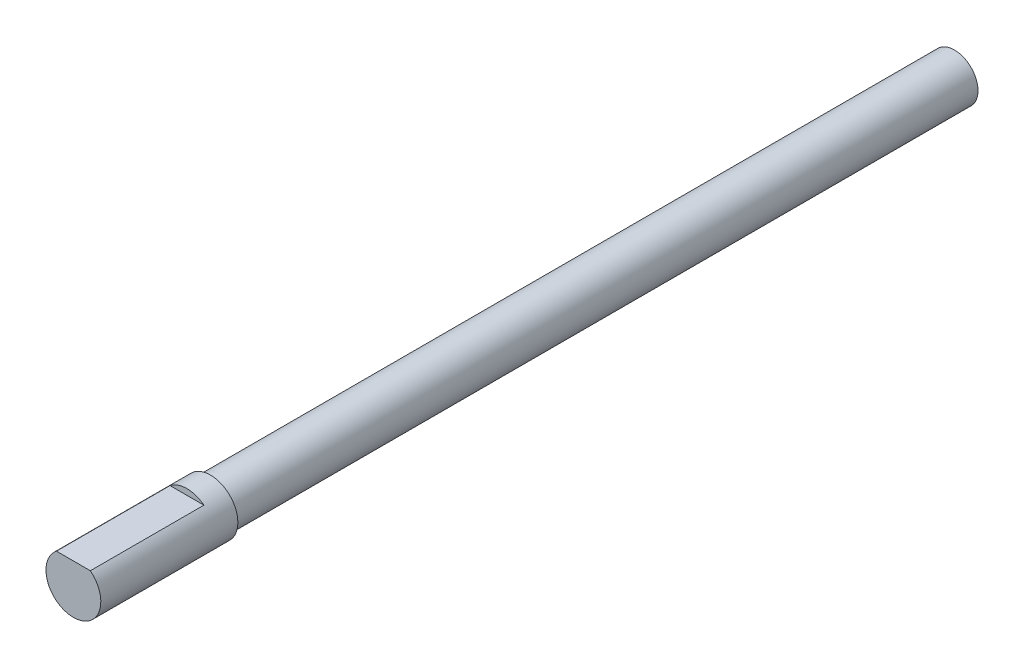
from build123d import *

# Parameters (mm, degrees)
ESQUISSE1_R             = 6
BOSS_EXTRU_1_DEPTH      = 190
ESQUISSE2_R             = 7
BOSS_EXTRU_2_DEPTH      = 35
ESQUISSE3_R             = 3
ENL_V_MAT_EXTRU_1_DEPTH = 20
ESQUISSE4_W             = 10.048379513
ESQUISSE4_H             = 5
ENL_V_MAT_EXTRU_2_DEPTH = 29


with BuildPart() as part:
    # Esquisse1 → Boss.-Extru.1 (new body)
    with BuildSketch(Plane.XY):
        Circle(ESQUISSE1_R)
    extrude(amount=BOSS_EXTRU_1_DEPTH)

    # Esquisse2 → Boss.-Extru.2 (add)
    with BuildSketch(Plane.XY.offset(190)):
        Circle(ESQUISSE2_R)
    extrude(amount=BOSS_EXTRU_2_DEPTH)

    # Esquisse3 → Enlèv. mat.-Extru.1 (cut)
    with BuildSketch(Plane(origin=(0, 0, 0), x_dir=(-1, 0, 0), z_dir=(0, 0, -1))):
        Circle(ESQUISSE3_R)
    extrude(amount=-ENL_V_MAT_EXTRU_1_DEPTH, mode=Mode.SUBTRACT)

    # Esquisse4 → Enlèv. mat.-Extru.2 (cut)
    with BuildSketch(Plane.XY.offset(225)):
        with Locations((0.381691631, 8)):
            Rectangle(ESQUISSE4_W, ESQUISSE4_H)
    extrude(amount=-ENL_V_MAT_EXTRU_2_DEPTH, mode=Mode.SUBTRACT)


solid = part.part
